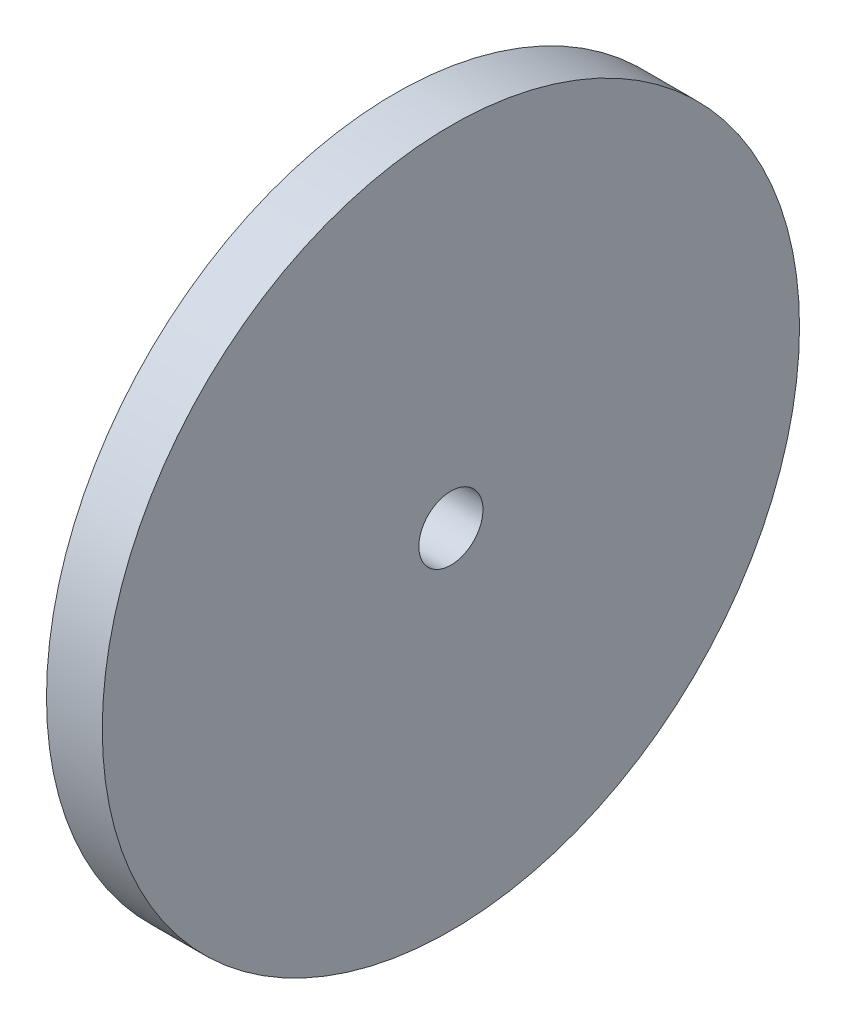
from build123d import *

# Parameters (mm, degrees)
SKETCH1_R           = 15.875
SKETCH1_R_2         = 1.4605
BOSS_EXTRUDE1_DEPTH = 2.54


with BuildPart() as part:
    # Sketch1 → Boss-Extrude1 (new body)
    with BuildSketch(Plane.YZ):
        with Locations(Location((0, 0, 0), (0, 0, 270))):
            Circle(SKETCH1_R)
        with Locations(Location((0, 0, 0), (0, 0, 270))):
            Circle(SKETCH1_R_2, mode=Mode.SUBTRACT)
    extrude(amount=BOSS_EXTRUDE1_DEPTH)


solid = part.part
